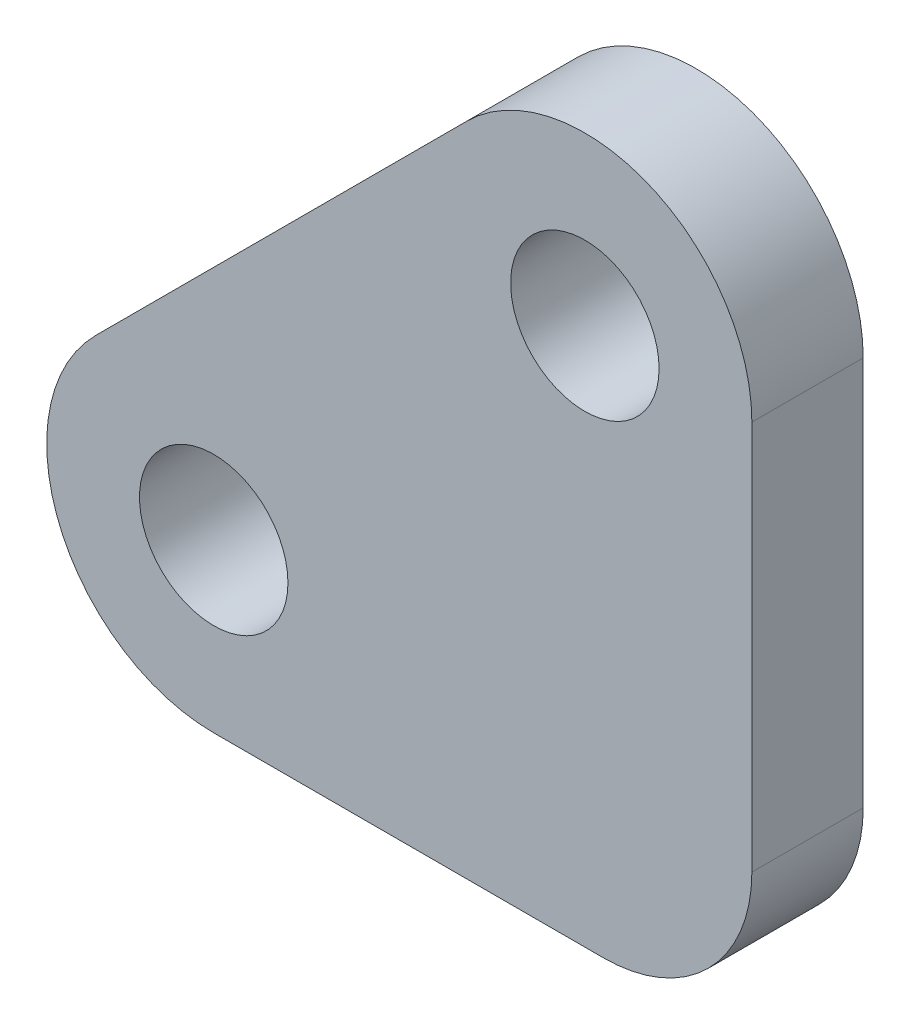
from build123d import *

# Parameters (mm, degrees)
ESQUISSE1_R        = 2
BOSS_EXTRU_1_DEPTH = 3
CONG_1_R           = 4


with BuildPart() as part:
    # Esquisse1 → Boss.-Extru.1 (new body)
    with BuildSketch(Plane.XY):
        with BuildLine():
            Line((-5, -9.5), (9.5, -9.5))
            Line((9.5, -9.5), (9.5, 5))
            ThreePointArc((9.5, 5), (6.722075446, 9.157457896), (1.818019485, 8.181980515))
            Line((1.818019485, 8.181980515), (-8.181980515, -1.818019485))
            ThreePointArc((-8.181980515, -1.818019485), (-9.157457896, -6.722075446), (-5, -9.5))
        make_face()
        with Locations((5, 5)):
            Circle(ESQUISSE1_R, mode=Mode.SUBTRACT)
        with Locations((-5, -5)):
            Circle(ESQUISSE1_R, mode=Mode.SUBTRACT)
    extrude(amount=BOSS_EXTRU_1_DEPTH)

    # Congé1
    cong_1_edges = [part.edges().sort_by_distance(p)[0] for p in [
        (9.5, -9.5, 1.5),
    ]]
    fillet(cong_1_edges, radius=CONG_1_R)


solid = part.part
